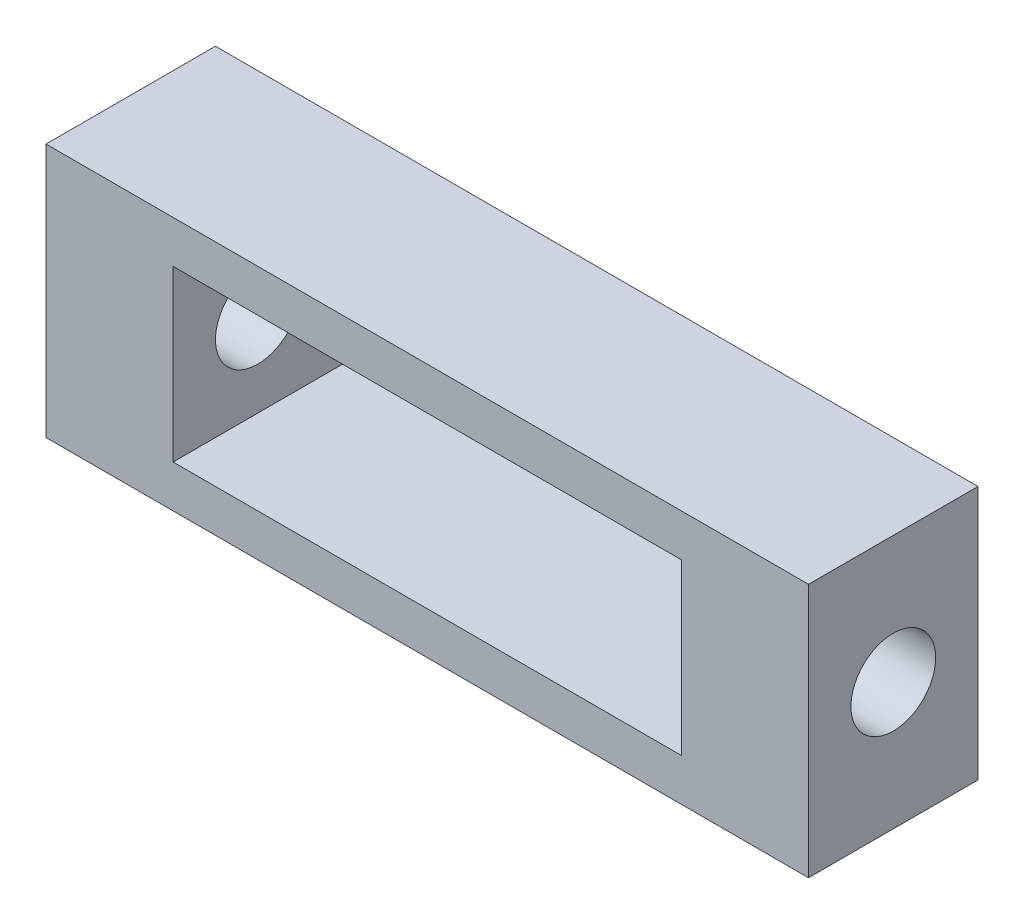
from build123d import *

# Parameters (mm, degrees)
SKETCH1_W           = 45
SKETCH1_H           = 15
SKETCH1_W_2         = 30
SKETCH1_H_2         = 10
BOSS_EXTRUDE1_DEPTH = 10
SKETCH2_R           = 2.5
CUT_EXTRUDE1_DEPTH  = 107


with BuildPart() as part:
    # Sketch1 → Boss-Extrude1 (new body)
    with BuildSketch(Plane.XY):
        with Locations((22.5, -7.5)):
            Rectangle(SKETCH1_W, SKETCH1_H)
        with Locations((22.5, -7.5)):
            Rectangle(SKETCH1_W_2, SKETCH1_H_2, mode=Mode.SUBTRACT)
    extrude(amount=BOSS_EXTRUDE1_DEPTH)

    # Sketch2 → Cut-Extrude1 (cut)
    with BuildSketch(Plane(origin=(45, 0, 0), x_dir=(0, 0, -1), z_dir=(1, 0, 0))):
        with Locations((-5, -7.5)):
            Circle(SKETCH2_R)
    extrude(amount=-CUT_EXTRUDE1_DEPTH, mode=Mode.SUBTRACT)


solid = part.part
